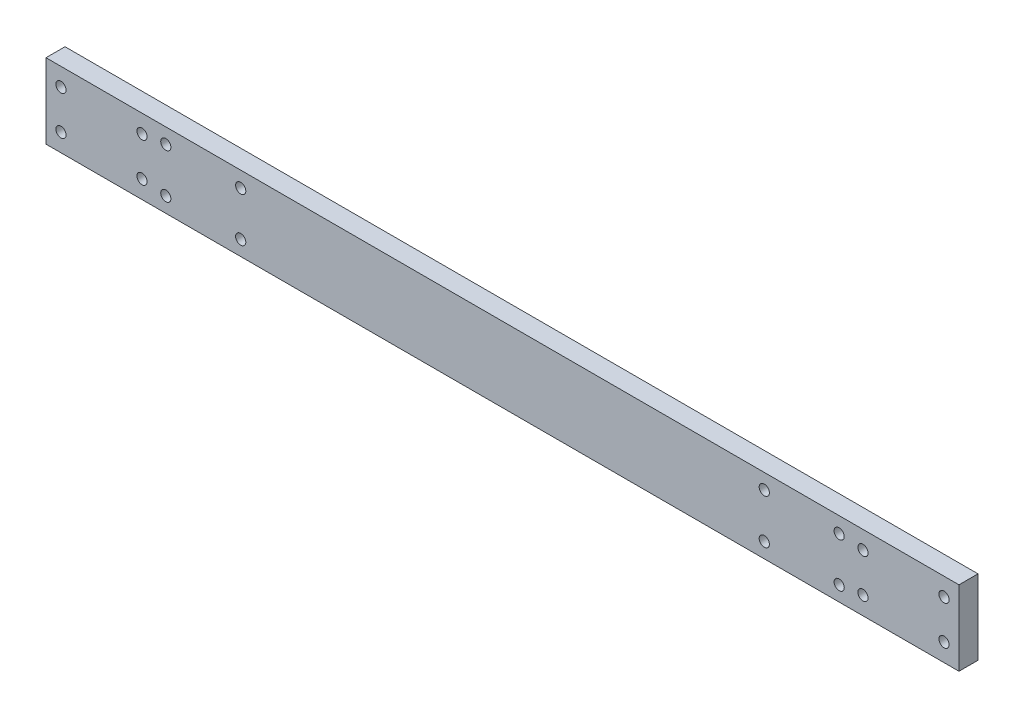
from build123d import *

# Parameters (mm, degrees)
SKETCH1_W           = 304.8
SKETCH1_H           = 25
BOSS_EXTRUDE1_DEPTH = 6.35
SKETCH2_R           = 1.7
CUT_EXTRUDE1_DEPTH  = 22


with BuildPart() as part:
    # Sketch1 → Boss-Extrude1 (new body)
    with BuildSketch(Plane.XY):
        with Locations((111.623766163, 223.42362241)):
            Rectangle(SKETCH1_W, SKETCH1_H)
    extrude(amount=BOSS_EXTRUDE1_DEPTH)

    # Sketch2 → Cut-Extrude1 (cut)
    with BuildSketch(Plane.XY.offset(6.35)):
        with Locations((-35.776233837, 229.92362241)):
            Circle(SKETCH2_R)
        with Locations((-35.776233837, 216.92362241)):
            Circle(SKETCH2_R)
        with Locations((-8.726233837, 229.92362241)):
            Circle(SKETCH2_R)
        with Locations((-8.726233837, 216.92362241)):
            Circle(SKETCH2_R)
        with Locations((-0.776233837, 230.865006717)):
            Circle(SKETCH2_R)
        with Locations((-0.776233837, 215.982232762)):
            Circle(SKETCH2_R)
        with Locations((24.223766163, 230.716645364)):
            Circle(SKETCH2_R)
        with Locations((24.223766163, 215.92362241)):
            Circle(SKETCH2_R)
        with Locations((199.023766163, 215.982232762)):
            Circle(SKETCH2_R)
        with Locations((199.023766163, 230.865006717)):
            Circle(SKETCH2_R)
        with Locations((224.023766163, 230.716645364)):
            Circle(SKETCH2_R)
        with Locations((224.023766163, 215.92362241)):
            Circle(SKETCH2_R)
        with Locations((231.973766163, 229.92362241)):
            Circle(SKETCH2_R)
        with Locations((231.973766163, 216.92362241)):
            Circle(SKETCH2_R)
        with Locations((259.023766163, 216.92362241)):
            Circle(SKETCH2_R)
        with Locations((259.023766163, 229.92362241)):
            Circle(SKETCH2_R)
    extrude(amount=-CUT_EXTRUDE1_DEPTH, mode=Mode.SUBTRACT)


solid = part.part
